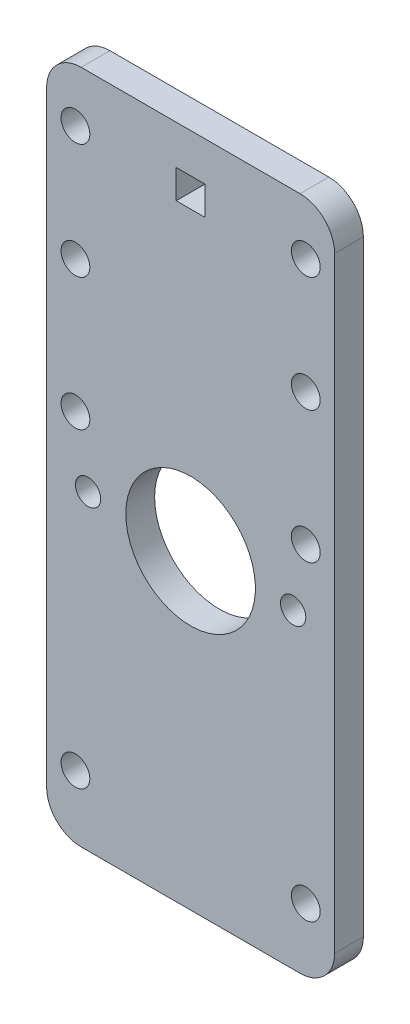
from build123d import *

# Parameters (mm, degrees)
BOSS_EXTRUDE1_DEPTH = 6.35
SKETCH2_R           = 1.35
SKETCH2_R_2         = 1.385
CUT_EXTRUDE1_DEPTH  = 38.116505762
SKETCH3_W           = 63.5
SKETCH3_H           = 88.9
SKETCH3_W_2         = 38.321076004
SKETCH3_H_2         = 47.237540142
BOSS_EXTRUDE2_DEPTH = 6.35
SKETCH5_W           = 27.94
SKETCH5_H           = 55.88
CUT_EXTRUDE3_DEPTH  = 61.153053743
SKETCH6_R           = 3.175
CUT_EXTRUDE4_DEPTH  = 61.153053743
SKETCH7_W           = 41.724968974
SKETCH7_H           = 57.858351452
BOSS_EXTRUDE3_DEPTH = 6.35
SKETCH8_R           = 14.2875
CUT_EXTRUDE5_DEPTH  = 6.35
SKETCH10_W          = 63.5
SKETCH10_H          = 60
SKETCH10_R          = 3.175
SKETCH10_W_2        = 6.35
SKETCH10_H_2        = 6.35
BOSS_EXTRUDE4_DEPTH = 6.35
FILLET1_R           = 7.62
SKETCH11_R          = 2.794
CUT_EXTRUDE6_DEPTH  = 104.404858197


with BuildPart() as part:
    # Sketch1 → Boss-Extrude1 (new body)
    with BuildSketch(Plane.XY):
        with BuildLine():
            Line((-19.69889026, 23.2987845), (-14.850045261, 29.75147823))
            ThreePointArc((-14.850045261, 29.75147823), (-14.144755454, 30.339267512), (-13.251155001, 30.55))
            Line((-13.251155001, 30.55), (13.251155001, 30.55))
            ThreePointArc((13.251155001, 30.55), (14.144755454, 30.339267512), (14.850045261, 29.75147823))
            Line((14.850045261, 29.75147823), (19.69889026, 23.2987845))
            ThreePointArc((19.69889026, 23.2987845), (19.997074131, 22.730638521), (20.1, 22.09730627))
            Line((20.1, 22.09730627), (20.1, -22.09730627))
            ThreePointArc((20.1, -22.09730627), (19.997074131, -22.730638521), (19.69889026, -23.2987845))
            Line((19.69889026, -23.2987845), (14.850045261, -29.75147823))
            ThreePointArc((14.850045261, -29.75147823), (14.144755454, -30.339267512), (13.251155001, -30.55))
            Line((13.251155001, -30.55), (-13.251155001, -30.55))
            ThreePointArc((-13.251155001, -30.55), (-14.144755454, -30.339267512), (-14.850045261, -29.75147823))
            Line((-14.850045261, -29.75147823), (-19.69889026, -23.2987845))
            ThreePointArc((-19.69889026, -23.2987845), (-19.997074131, -22.730638521), (-20.1, -22.09730627))
            Line((-20.1, -22.09730627), (-20.1, 22.09730627))
            ThreePointArc((-20.1, 22.09730627), (-19.997074131, 22.730638521), (-19.69889026, 23.2987845))
        make_face()
    extrude(amount=-BOSS_EXTRUDE1_DEPTH)

    # Sketch2 → Cut-Extrude1 (cut, through all)
    with BuildSketch(Plane(origin=(0, 0, -6.35), x_dir=(-1, 0, 0), z_dir=(0, 0, -1))):
        with Locations((17.3, 21.9487845)):
            Circle(SKETCH2_R)
        with Locations((17.3, -0.0512155)):
            Circle(SKETCH2_R)
        with Locations((17.3, -22.0512155)):
            Circle(SKETCH2_R)
        with Locations((11, -27.75)):
            Circle(SKETCH2_R_2)
        with Locations(Location((-11, -27.75, 0), (0, 0, 180))):
            Circle(SKETCH2_R_2)
        with Locations(Location((-17.3, -22.0512155, 0), (0, 0, 180))):
            Circle(SKETCH2_R)
        with Locations(Location((-17.3, -0.0512155, 0), (0, 0, 180))):
            Circle(SKETCH2_R)
        with Locations(Location((-17.3, 21.9487845, 0), (0, 0, 180))):
            Circle(SKETCH2_R)
    extrude(amount=-CUT_EXTRUDE1_DEPTH, mode=Mode.SUBTRACT)

    # Sketch3 → Boss-Extrude2 (add)
    with BuildSketch(Plane(origin=(0, 0, -6.35), x_dir=(-1, 0, 0), z_dir=(0, 0, -1))):
        with Locations((0, -6.2452155)):
            Rectangle(SKETCH3_W, SKETCH3_H)
        Rectangle(SKETCH3_W_2, SKETCH3_H_2, mode=Mode.SUBTRACT)
    extrude(amount=-BOSS_EXTRUDE2_DEPTH)

    # Sketch5 → Cut-Extrude3 (cut, through all)
    with BuildSketch(Plane.XY):
        with Locations((0, 3.0087845)):
            Rectangle(SKETCH5_W, SKETCH5_H)
    extrude(amount=-CUT_EXTRUDE3_DEPTH, mode=Mode.SUBTRACT)

    # Sketch6 → Cut-Extrude4 (cut, through all)
    with BuildSketch(Plane(origin=(0, 0, -6.35), x_dir=(-1, 0, 0), z_dir=(0, 0, -1))):
        with Locations((25.4, 31.8547845)):
            Circle(SKETCH6_R)
        with Locations((-25.4, 31.8547845)):
            Circle(SKETCH6_R)
        with Locations((-25.4, -36.7252155)):
            Circle(SKETCH6_R)
        with Locations((25.4, -36.7252155)):
            Circle(SKETCH6_R)
    extrude(amount=-CUT_EXTRUDE4_DEPTH, mode=Mode.SUBTRACT)

    # Sketch7 → Boss-Extrude3 (add)
    with BuildSketch(Plane(origin=(0, 0, -6.35), x_dir=(-1, 0, 0), z_dir=(0, 0, -1))):
        with Locations((0, 3.16744248)):
            Rectangle(SKETCH7_W, SKETCH7_H)
    extrude(amount=-BOSS_EXTRUDE3_DEPTH)

    # Sketch8 → Cut-Extrude5 (cut)
    with BuildSketch(Plane(origin=(0, 0, -6.35), x_dir=(-1, 0, 0), z_dir=(0, 0, -1))):
        with Locations((0, 17.8847845)):
            Circle(SKETCH8_R)
    extrude(amount=-CUT_EXTRUDE5_DEPTH, mode=Mode.SUBTRACT)

    # Sketch10 → Boss-Extrude4 (add)
    with BuildSketch(Plane(origin=(0, 0, -6.35), x_dir=(-1, 0, 0), z_dir=(0, 0, -1))):
        with Locations((0, 68.2047845)):
            Rectangle(SKETCH10_W, SKETCH10_H)
        with Locations((-25.4, 86.3797845)):
            Circle(SKETCH10_R, mode=Mode.SUBTRACT)
        with Locations((-25.4, 60.9797845)):
            Circle(SKETCH10_R, mode=Mode.SUBTRACT)
        with Locations(Location((25.4, 60.9797845, 0), (0, 0, 180))):
            Circle(SKETCH10_R, mode=Mode.SUBTRACT)
        with Locations(Location((25.4, 86.3797845, 0), (0, 0, 180))):
            Circle(SKETCH10_R, mode=Mode.SUBTRACT)
        with Locations((0, 86.3797845)):
            Rectangle(SKETCH10_W_2, SKETCH10_H_2, mode=Mode.SUBTRACT)
    extrude(amount=-BOSS_EXTRUDE4_DEPTH)

    # Fillet1
    fillet1_edges = [part.edges().sort_by_distance(p)[0] for p in [
        (31.75, 98.2047845, -3.175),
        (-31.75, 98.2047845, -3.175),
        (-31.75, -50.6952155, -3.175),
        (31.75, -50.6952155, -3.175),
    ]]
    fillet(fillet1_edges, radius=FILLET1_R)

    # Sketch11 → Cut-Extrude6 (cut, through all)
    with BuildSketch(Plane.XY):
        with Locations((-22.61, 17.8847845)):
            Circle(SKETCH11_R)
        with Locations((22.61, 17.8847845)):
            Circle(SKETCH11_R)
    extrude(amount=-CUT_EXTRUDE6_DEPTH, mode=Mode.SUBTRACT)


solid = part.part
